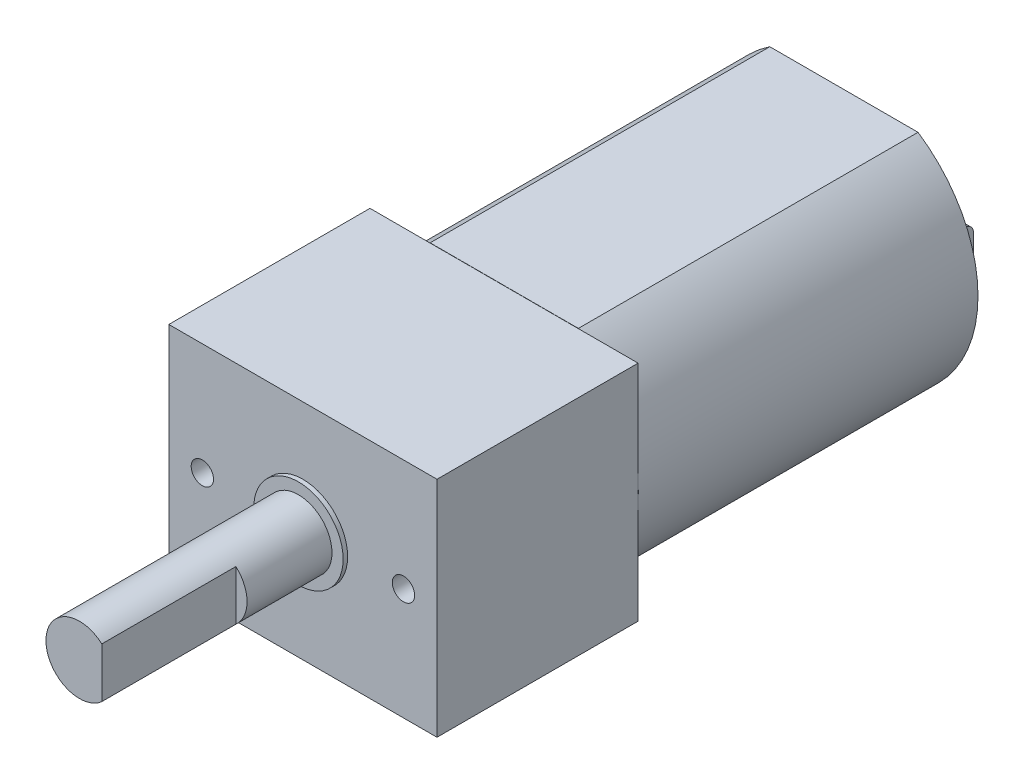
from build123d import *

# Parameters (mm, degrees)
SKETCH_1_W          = 0.3
SKETCH_1_H          = 1.5
SKETCH_1_R          = 2.5
SKETCH_1_R_2        = 1.5
EXTRUDE_1_DEPTH     = 15.2
SKETCH_1_4_W        = 0.3
SKETCH_1_4_H        = 1.5
EXTRUDE_2_DEPTH     = 2
CUT_EXTRUDE_2_DEPTH = 19.763794925
FILLET_1_R          = 0.4
SKETCH_1_5_R        = 2.5
SKETCH_1_5_R_2      = 1.5
EXTRUDE_3_DEPTH     = 1.2
CUT_EXTRUDE_START   = -1.2
SKETCH_1_7_R        = 1.5
CUT_EXTRUDE_1_DEPTH = 0.6
FILLET_2_R          = 0.4
SKETCH_3_R          = 2
EXTRUDE_4_DEPTH     = 0.5
SKETCH_3_3_R        = 0.5
EXTRUDE_5_DEPTH     = 3
SKETCH_4_R          = 0.7
SKETCH_4_R_2        = 0.5
CUT_EXTRUDE_3_DEPTH = 1
EXTRUDE_START       = 0.01
SKETCH_5_W          = 12
SKETCH_5_H          = 10
EXTRUDE_6_DEPTH     = 9
SKETCH_6_R          = 2
EXTRUDE_7_DEPTH     = 0.2
SKETCH_6_4_R        = 1.5
EXTRUDE_8_DEPTH     = 4
EXTRUDE_START_2     = 4
EXTRUDE_9_DEPTH     = 6
SKETCH_7_R          = 0.5
CUT_EXTRUDE_5_DEPTH = 5.8


with BuildPart() as part:
    # 草图1 → 凸台-拉伸1 (new body)
    # profile 1 of 5: a face of its own
    with BuildSketch(Plane.XY):
        with BuildLine():
            ThreePointArc((-6, 0), (-5.286764074, -2.837274331), (-3.31662479, -5))
            Line((-3.31662479, -5), (3.31662479, -5))
            ThreePointArc((3.31662479, -5), (5.286764074, -2.837274331), (6, 0))
            ThreePointArc((6, 0), (5.286764074, 2.837274331), (3.31662479, 5))
            Line((3.31662479, 5), (-3.31662479, 5))
            ThreePointArc((-3.31662479, 5), (-5.286764074, 2.837274331), (-6, 0))
        make_face()
        with Locations((-3.65, 0)):
            Rectangle(SKETCH_1_W, SKETCH_1_H, mode=Mode.SUBTRACT)
        Circle(SKETCH_1_R, mode=Mode.SUBTRACT)
        with Locations((3.65, 0)):
            Rectangle(SKETCH_1_W, SKETCH_1_H, mode=Mode.SUBTRACT)
    # profile 2 of 5: a face of its own
    with BuildSketch(Plane.XY):
        Circle(SKETCH_1_R)
        Circle(SKETCH_1_R_2, mode=Mode.SUBTRACT)
    # profile 3 of 5: a face of its own
    with BuildSketch(Plane.XY):
        Circle(SKETCH_1_R_2)
    # profile 4 of 5: a face of its own
    with BuildSketch(Plane.XY):
        with Locations((3.65, 0)):
            Rectangle(SKETCH_1_W, SKETCH_1_H)
    # profile 5 of 5: a face of its own
    with BuildSketch(Plane.XY):
        with Locations((-3.65, 0)):
            Rectangle(SKETCH_1_W, SKETCH_1_H)
    extrude(amount=EXTRUDE_1_DEPTH)

    # 草图1<4> → 凸台-拉伸2 (add)
    with BuildSketch(Plane.XY):
        with Locations((3.65, 0)):
            Rectangle(SKETCH_1_4_W, SKETCH_1_4_H)
        with Locations((-3.65, 0)):
            Rectangle(SKETCH_1_4_W, SKETCH_1_4_H)
    extrude(amount=-EXTRUDE_2_DEPTH)

    # 草图2 → 切除-拉伸2 (cut, through all)
    with BuildSketch(Plane(origin=(3.8, 0, 0), x_dir=(0, 0, -1), z_dir=(1, 0, 0))):
        with BuildLine():
            Line((0.95, 0.45), (1.05, 0.45))
            ThreePointArc((1.05, 0.45), (1.5, 0), (1.05, -0.45))
            Line((1.05, -0.45), (0.95, -0.45))
            ThreePointArc((0.95, -0.45), (0.5, 0), (0.95, 0.45))
        make_face()
    extrude(amount=-CUT_EXTRUDE_2_DEPTH, mode=Mode.SUBTRACT)

    # 圆角1
    fillet_1_edges = [part.edges().sort_by_distance(p)[0] for p in [
        (3.65, -0.75, -2),
        (3.65, 0.75, -2),
        (-3.65, -0.75, -2),
        (-3.65, 0.75, -2),
    ]]
    fillet(fillet_1_edges, radius=FILLET_1_R)

    # 草图1<5> → 凸台-拉伸3 (add)
    # profile 1 of 2: a face of its own
    with BuildSketch(Plane.XY):
        Circle(SKETCH_1_5_R)
        Circle(SKETCH_1_5_R_2, mode=Mode.SUBTRACT)
    # profile 2 of 2: a face of its own
    with BuildSketch(Plane.XY):
        Circle(SKETCH_1_5_R_2)
    extrude(amount=-EXTRUDE_3_DEPTH)

    # 草图1<7> → 切除-拉伸1 (cut)
    with BuildSketch(Plane.XY.offset(CUT_EXTRUDE_START)):
        Circle(SKETCH_1_7_R)
    extrude(amount=CUT_EXTRUDE_1_DEPTH, mode=Mode.SUBTRACT)

    # 圆角2
    fillet_2_edges = [part.edges().sort_by_distance(p)[0] for p in [
        (-2.5, 0, -1.2),
    ]]
    fillet(fillet_2_edges, radius=FILLET_2_R)

    # 草图3 → 凸台-拉伸4 (add)
    with BuildSketch(Plane.XY.offset(15.2)):
        Circle(SKETCH_3_R)
    extrude(amount=EXTRUDE_4_DEPTH)

    # 草图3<3> → 凸台-拉伸5 (add)
    with BuildSketch(Plane.XY.offset(15.2)):
        Circle(SKETCH_3_3_R)
    extrude(amount=EXTRUDE_5_DEPTH)

    # 草图4 → 切除-拉伸3 (cut)
    with BuildSketch(Plane.XY.offset(15.2)):
        with Locations((-4.25, 0)):
            Circle(SKETCH_4_R)
        with Locations((4.25, 0)):
            Circle(SKETCH_4_R)
        with Locations((0, 3.5)):
            Circle(SKETCH_4_R_2)
    extrude(amount=-CUT_EXTRUDE_3_DEPTH, mode=Mode.SUBTRACT)

    # 草图5 → 凸台-拉伸6 (add)
    with BuildSketch(Plane.XY.offset(15.2).offset(EXTRUDE_START)):
        Rectangle(SKETCH_5_W, SKETCH_5_H)
    extrude(amount=EXTRUDE_6_DEPTH)

    # 草图6 → 凸台-拉伸7 (add)
    with BuildSketch(Plane.XY.offset(24.21)):
        Circle(SKETCH_6_R)
    extrude(amount=EXTRUDE_7_DEPTH)

    # 草图6<4> → 凸台-拉伸8 (add)
    with BuildSketch(Plane.XY.offset(24.21)):
        Circle(SKETCH_6_4_R)
    extrude(amount=EXTRUDE_8_DEPTH)

    # 草图6<5> → 凸台-拉伸9 (add)
    with BuildSketch(Plane.XY.offset(24.21).offset(EXTRUDE_START_2)):
        with BuildLine():
            Line((1, -1.118033989), (1, 1.118033989))
            ThreePointArc((1, 1.118033989), (-1.5, 0), (1, -1.118033989))
        make_face()
    extrude(amount=EXTRUDE_9_DEPTH)

    # 草图7 → 切除-拉伸5 (cut)
    with BuildSketch(Plane.XY.offset(24.21)):
        with Locations((-4.5, 0)):
            Circle(SKETCH_7_R)
        with Locations((4.5, 0)):
            Circle(SKETCH_7_R)
    extrude(amount=-CUT_EXTRUDE_5_DEPTH, mode=Mode.SUBTRACT)


solid = part.part
